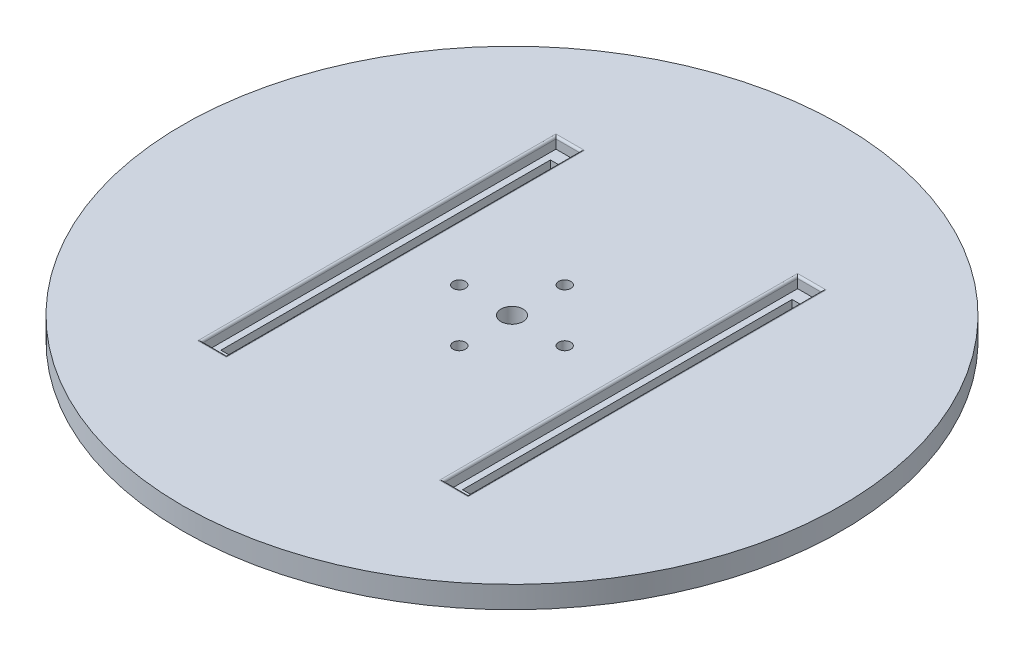
from build123d import *

# Parameters (mm, degrees)
SKETCH1_R                = 75
BOSS_EXTRUDE1_DEPTH      = 5
SKETCH2_R                = 2.5
CUT_EXTRUDE1_DEPTH       = 5
SKETCH3_R                = 1.4
CUT_EXTRUDE2_DEPTH       = 5
CIRPATTERN1_COUNT        = 4
SKETCH4_W                = 5.5
SKETCH4_H                = 80.5
CUT_EXTRUDE3_DEPTH       = 2.5
SKETCH5_W                = 2.5
SKETCH5_H                = 75
CUT_EXTRUDE4_DEPTH       = 2.5
FILLET1_R                = 0.5
CIRPATTERN2_COUNT        = 2
FILLET1_OF_CIRPATTERN2_R = 0.5


with BuildPart() as part:
    # Sketch1 → Boss-Extrude1 (new body)
    with BuildSketch(Plane(origin=(0, 0, 0), x_dir=(1, 0, 0), z_dir=(0, 1, 0))):
        with Locations(Location((0, 0, 0), (0, 0, 270))):
            Circle(SKETCH1_R)
    extrude(amount=BOSS_EXTRUDE1_DEPTH)

    # Sketch2 → Cut-Extrude1 (cut)
    with BuildSketch(Plane(origin=(0, 5, 0), x_dir=(1, 0, 0), z_dir=(0, 1, 0))):
        with Locations(Location((0, 0, 0), (0, 0, 270))):
            Circle(SKETCH2_R)
    extrude(amount=-CUT_EXTRUDE1_DEPTH, mode=Mode.SUBTRACT)

    # Sketch3 → Cut-Extrude2 (cut)
    with BuildSketch(Plane(origin=(0, 5, 0), x_dir=(1, 0, 0), z_dir=(0, 1, 0))):
        with Locations(Location((0, 12, 0), (0, 0, 270))):
            Circle(SKETCH3_R)
    cut_extrude2 = extrude(amount=-CUT_EXTRUDE2_DEPTH, mode=Mode.SUBTRACT)

    # CirPattern1: Cut-Extrude2 ×4 about axis
    cirpattern1_axis = Axis((0, 0, 0), (0, 1, 0))
    for i in range(1, CIRPATTERN1_COUNT):
        add(cut_extrude2.rotate(cirpattern1_axis, i * 360 / CIRPATTERN1_COUNT), mode=Mode.SUBTRACT)

    # Sketch4 → Cut-Extrude3 (cut)
    with BuildSketch(Plane(origin=(0, 5, 0), x_dir=(1, 0, 0), z_dir=(0, 1, 0))):
        with Locations((-27.5, 0)):
            Rectangle(SKETCH4_W, SKETCH4_H)
    cut_extrude3 = extrude(amount=-CUT_EXTRUDE3_DEPTH, mode=Mode.SUBTRACT)

    # Sketch5 → Cut-Extrude4 (cut)
    with BuildSketch(Plane(origin=(0, 2.5, 0), x_dir=(1, 0, 0), z_dir=(0, 1, 0))):
        with Locations((-27.5, 0)):
            Rectangle(SKETCH5_W, SKETCH5_H)
    cut_extrude4 = extrude(amount=-CUT_EXTRUDE4_DEPTH, mode=Mode.SUBTRACT)

    # Fillet1
    fillet1_edges = [part.edges().sort_by_distance(p)[0] for p in [
        (-24.75, 5, 0),
        (-27.5, 5, -40.25),
        (-30.25, 5, 0),
        (-27.5, 5, 40.25),
    ]]
    fillet(fillet1_edges, radius=FILLET1_R)

    # CirPattern2: Cut-Extrude3, Cut-Extrude4 ×2 about axis
    cirpattern2_axis = Axis((0, 0, 0), (0, 1, 0))
    add([cut_extrude3.rotate(cirpattern2_axis, i * 360 / CIRPATTERN2_COUNT) for i in range(1, CIRPATTERN2_COUNT)], mode=Mode.SUBTRACT)
    add([cut_extrude4.rotate(cirpattern2_axis, i * 360 / CIRPATTERN2_COUNT) for i in range(1, CIRPATTERN2_COUNT)], mode=Mode.SUBTRACT)

    # Fillet1 of CirPattern2
    fillet1_of_cirpattern2_edges = [part.edges().sort_by_distance(p)[0] for p in [
        (24.75, 5, 0),
        (27.5, 5, 40.25),
        (30.25, 5, 0),
        (27.5, 5, -40.25),
    ]]
    fillet(fillet1_of_cirpattern2_edges, radius=FILLET1_OF_CIRPATTERN2_R)


solid = part.part
